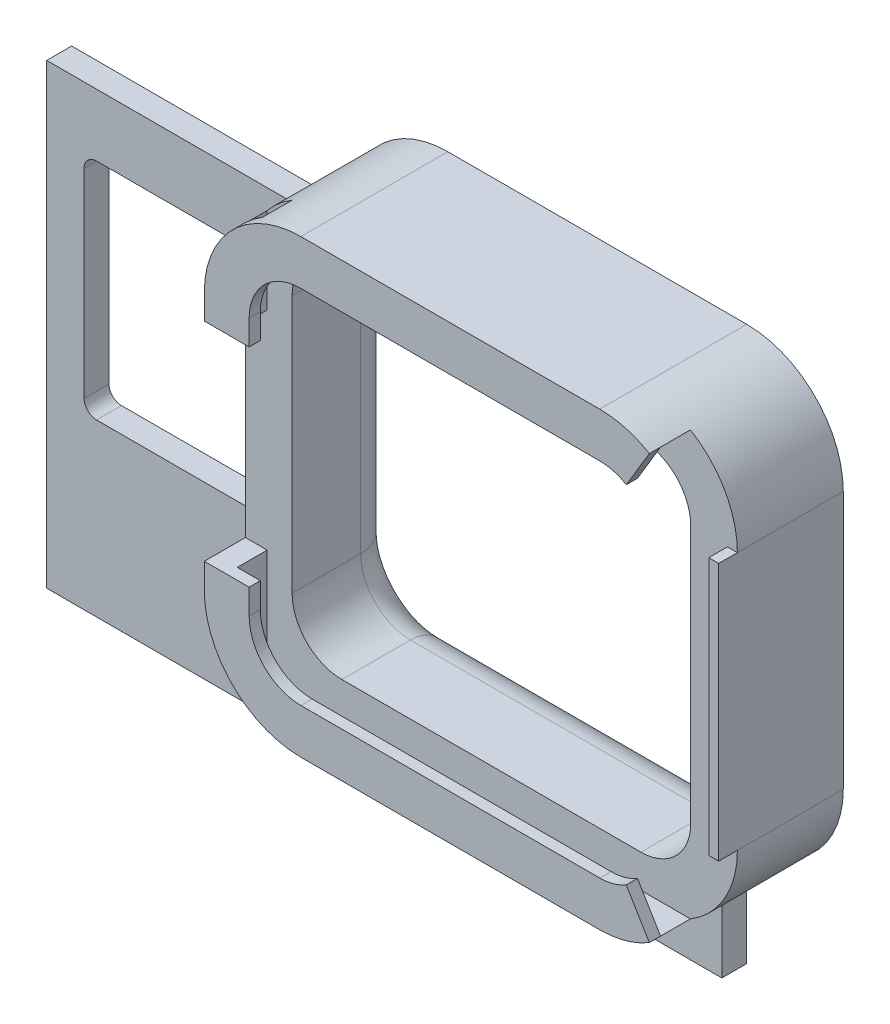
from build123d import *
from build123d.topology import SkipClean

# Parameters (mm, degrees)
SALIENTE_EXTRUIR1_DEPTH = 2
SALIENTE_EXTRUIR2_DEPTH = 6.5
SALIENTE_EXTRUIR4_DEPTH = 2.4
SALIENTE_EXTRUIR5_START = 2.4
SALIENTE_EXTRUIR5_DEPTH = 0.9
REDONDEO1_R             = 3
CROQUIS8_W              = 0.8
CROQUIS8_H              = 20.7
SALIENTE_EXTRUIR6_DEPTH = 1.5
CROQUIS9_W              = 18
CROQUIS9_H              = 18
CORTAR_EXTRUIR1_DEPTH   = 2
REDONDEO2_R             = 1


with BuildPart() as part:
    # Croquis1 → Saliente-Extruir1 (new body)
    with BuildSketch(Plane.XY):
        with BuildLine():
            Line((-198.83724752, 71.433656958), (-144.63724752, 71.433656958))
            Line((-144.63724752, 71.433656958), (-144.63724752, 79.683656958))
            ThreePointArc((-144.63724752, 79.683656958), (-139.157169966, 81.953579404), (-136.88724752, 87.433656958))
            Line((-136.88724752, 87.433656958), (-136.88724752, 108.133656958))
            ThreePointArc((-136.88724752, 108.133656958), (-139.157169966, 113.613734512), (-144.63724752, 115.883656958))
            Line((-144.63724752, 115.883656958), (-168.63724752, 115.883656958))
            ThreePointArc((-168.63724752, 115.883656958), (-174.117325074, 113.613734512), (-176.38724752, 108.133656958))
            Line((-176.38724752, 108.133656958), (-198.83724752, 108.133656958))
            Line((-198.83724752, 108.133656958), (-198.83724752, 71.433656958))
        make_face()
        with BuildLine():
            Line((-144.63724752, 83.433656958), (-168.63724752, 83.433656958))
            ThreePointArc((-168.63724752, 83.433656958), (-171.465674645, 84.605229833), (-172.63724752, 87.433656958))
            Line((-172.63724752, 87.433656958), (-172.63724752, 108.133656958))
            ThreePointArc((-172.63724752, 108.133656958), (-171.465674645, 110.962084083), (-168.63724752, 112.133656958))
            Line((-168.63724752, 112.133656958), (-144.63724752, 112.133656958))
            ThreePointArc((-144.63724752, 112.133656958), (-141.808820395, 110.962084083), (-140.63724752, 108.133656958))
            Line((-140.63724752, 108.133656958), (-140.63724752, 87.433656958))
            ThreePointArc((-140.63724752, 87.433656958), (-141.808820395, 84.605229833), (-144.63724752, 83.433656958))
        make_face(mode=Mode.SUBTRACT)
    extrude(amount=SALIENTE_EXTRUIR1_DEPTH)

    # Croquis3 → Saliente-Extruir2 (add)
    with BuildSketch(Plane.XY.offset(2)):
        with BuildLine():
            Line((-136.88724752, 87.433656958), (-136.88724752, 108.133656958))
            ThreePointArc((-136.88724752, 108.133656958), (-139.157169966, 113.613734512), (-144.63724752, 115.883656958))
            Line((-144.63724752, 115.883656958), (-168.63724752, 115.883656958))
            ThreePointArc((-168.63724752, 115.883656958), (-174.117325074, 113.613734512), (-176.38724752, 108.133656958))
            Line((-176.38724752, 108.133656958), (-176.38724752, 87.433656958))
            ThreePointArc((-176.38724752, 87.433656958), (-174.117325074, 81.953579404), (-168.63724752, 79.683656958))
            Line((-168.63724752, 79.683656958), (-144.63724752, 79.683656958))
            ThreePointArc((-144.63724752, 79.683656958), (-139.157169966, 81.953579404), (-136.88724752, 87.433656958))
        make_face()
        with BuildLine():
            Line((-140.63724752, 87.433656958), (-140.63724752, 108.133656958))
            ThreePointArc((-140.63724752, 108.133656958), (-141.808820395, 110.962084083), (-144.63724752, 112.133656958))
            Line((-144.63724752, 112.133656958), (-168.63724752, 112.133656958))
            ThreePointArc((-168.63724752, 112.133656958), (-171.465674645, 110.962084083), (-172.63724752, 108.133656958))
            Line((-172.63724752, 108.133656958), (-172.63724752, 87.433656958))
            ThreePointArc((-172.63724752, 87.433656958), (-171.465674645, 84.605229833), (-168.63724752, 83.433656958))
            Line((-168.63724752, 83.433656958), (-144.63724752, 83.433656958))
            ThreePointArc((-144.63724752, 83.433656958), (-141.808820395, 84.605229833), (-140.63724752, 87.433656958))
        make_face(mode=Mode.SUBTRACT)
    extrude(amount=SALIENTE_EXTRUIR2_DEPTH)

    # Croquis6 → Saliente-Extruir4 (add)
    with SkipClean():  # the faces are left unmerged after this step: merging them gives an invalid solid
        with BuildSketch(Plane.XY.offset(8.5)):
            with BuildLine():
                Line((-172.617197268, 114.783656958), (-140.657297772, 114.783656958))
                ThreePointArc((-140.657297772, 114.783656958), (-142.572665238, 115.603596717), (-144.63724752, 115.883656958))
                Line((-144.63724752, 115.883656958), (-168.63724752, 115.883656958))
                ThreePointArc((-168.63724752, 115.883656958), (-170.701829802, 115.603596717), (-172.617197268, 114.783656958))
            make_face()
            with BuildLine():
                Line((-144.63724752, 79.683656958), (-168.63724752, 79.683656958))
                ThreePointArc((-168.63724752, 79.683656958), (-170.701829802, 79.963717199), (-172.617197268, 80.783656958))
                Line((-172.617197268, 80.783656958), (-140.657297772, 80.783656958))
                ThreePointArc((-140.657297772, 80.783656958), (-142.572665238, 79.963717199), (-144.63724752, 79.683656958))
            make_face()
            with BuildLine():
                Line((-174.63724752, 113.039011176), (-174.63724752, 106.133656958))
                Line((-174.63724752, 106.133656958), (-176.38724752, 106.133656958))
                Line((-176.38724752, 106.133656958), (-176.38724752, 108.133656958))
                ThreePointArc((-176.38724752, 108.133656958), (-175.93664818, 110.73774029), (-174.63724752, 113.039011176))
            make_face()
            with BuildLine():
                Line((-176.38724752, 87.433656958), (-176.38724752, 89.433656958))
                Line((-176.38724752, 89.433656958), (-174.63724752, 89.433656958))
                Line((-174.63724752, 89.433656958), (-174.63724752, 82.52830274))
                ThreePointArc((-174.63724752, 82.52830274), (-175.93664818, 84.829573626), (-176.38724752, 87.433656958))
            make_face()
        extrude(amount=SALIENTE_EXTRUIR4_DEPTH)

    # Croquis7 → Saliente-Extruir5 (add)
    with SkipClean():  # the faces are left unmerged after this step: merging them gives an invalid solid
        with BuildSketch(Plane.XY.offset(8.5).offset(SALIENTE_EXTRUIR5_START)):
            with BuildLine():
                Line((-172.78724752, 106.133656958), (-172.78724752, 108.133656958))
                ThreePointArc((-172.78724752, 108.133656958), (-171.571740662, 111.0681501), (-168.63724752, 112.283656958))
                Line((-168.63724752, 112.283656958), (-144.63724752, 112.283656958))
                ThreePointArc((-144.63724752, 112.283656958), (-143.531697008, 112.133689216), (-142.506048622, 111.6946247))
                Line((-142.506048622, 111.6946247), (-140.657297772, 114.783656958))
                ThreePointArc((-140.657297772, 114.783656958), (-142.572665238, 115.603596717), (-144.63724752, 115.883656958))
                Line((-144.63724752, 115.883656958), (-168.63724752, 115.883656958))
                ThreePointArc((-168.63724752, 115.883656958), (-174.117325074, 113.613734512), (-176.38724752, 108.133656958))
                Line((-176.38724752, 108.133656958), (-176.38724752, 106.133656958))
                Line((-176.38724752, 106.133656958), (-172.78724752, 106.133656958))
            make_face()
            with BuildLine():
                Line((-168.63724752, 79.683656958), (-144.63724752, 79.683656958))
                ThreePointArc((-144.63724752, 79.683656958), (-142.572665238, 79.963717199), (-140.657297772, 80.783656958))
                Line((-140.657297772, 80.783656958), (-142.506048622, 83.872689216))
                ThreePointArc((-142.506048622, 83.872689216), (-143.531697008, 83.4336247), (-144.63724752, 83.283656958))
                Line((-144.63724752, 83.283656958), (-168.63724752, 83.283656958))
                ThreePointArc((-168.63724752, 83.283656958), (-171.571740662, 84.499163816), (-172.78724752, 87.433656958))
                Line((-172.78724752, 87.433656958), (-172.78724752, 89.433656958))
                Line((-172.78724752, 89.433656958), (-176.38724752, 89.433656958))
                Line((-176.38724752, 89.433656958), (-176.38724752, 87.433656958))
                ThreePointArc((-176.38724752, 87.433656958), (-174.117325074, 81.953579404), (-168.63724752, 79.683656958))
            make_face()
        extrude(amount=SALIENTE_EXTRUIR5_DEPTH)

    # Redondeo1
    redondeo1_edges = [part.edges().sort_by_distance(p)[0] for p in [
        (-141.808820395, 84.605229833, 0),
        (-140.63724752, 97.783656958, 0),
        (-141.808820395, 110.962084083, 0),
        (-156.63724752, 112.133656958, 0),
        (-171.465674645, 110.962084083, 0),
        (-172.63724752, 97.783656958, 0),
        (-171.465674645, 84.605229833, 0),
        (-156.63724752, 83.433656958, 0),
    ]]
    fillet(redondeo1_edges, radius=REDONDEO1_R)

    # Croquis8 → Saliente-Extruir6 (add)
    with SkipClean():  # the faces are left unmerged after this step: merging them gives an invalid solid
        with BuildSketch(Plane.XY.offset(8.5)):
            with Locations((-137.28724752, 97.783656958)):
                Rectangle(CROQUIS8_W, CROQUIS8_H)
        extrude(amount=SALIENTE_EXTRUIR6_DEPTH)

    # Croquis9 → Cortar-Extruir1 (cut)
    with SkipClean():  # the faces are left unmerged after this step: merging them gives an invalid solid
        with BuildSketch(Plane.XY.offset(2)):
            with Locations((-186.83724752, 94.133656958)):
                Rectangle(CROQUIS9_W, CROQUIS9_H)
        extrude(amount=-CORTAR_EXTRUIR1_DEPTH, mode=Mode.SUBTRACT)

    # Redondeo2
    redondeo2_edges = [part.edges().sort_by_distance(p)[0] for p in [
        (-177.83724752, 85.133656958, 1),
        (-177.83724752, 103.133656958, 1),
        (-195.83724752, 103.133656958, 1),
        (-195.83724752, 85.133656958, 1),
    ]]
    fillet(redondeo2_edges, radius=REDONDEO2_R)


solid = part.part
